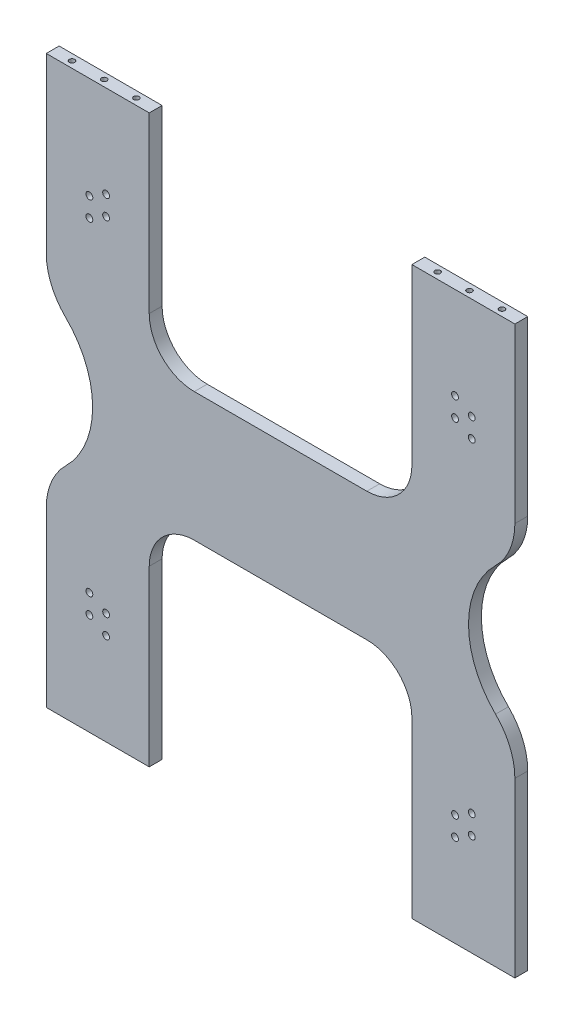
from build123d import *

# Parameters (mm, degrees)
SALIENTE_EXTRUIR1_DEPTH                              = 10
PERFORADOR_PARA_ROSCAR_PARA_MACHO_DE_2_COUNT         = 2
PERFORADOR_PARA_ROSCAR_PARA_MACHO_DE_2_PITCH         = 50
PERFORADOR_PARA_ROSCAR_PARA_MACHO_DE_3_COUNT         = 2
PERFORADOR_PARA_ROSCAR_PARA_MACHO_DE_3_PITCH         = 114.274917137
PERFORADOR_PARA_ROSCAR_PARA_MACHO_DE_4_COUNT         = 2
PERFORADOR_PARA_ROSCAR_PARA_MACHO_DE_4_PITCH         = 25
PERFORADOR_PARA_ROSCAR_PARA_MACHO_DE_5_A_COUNT       = 2
PERFORADOR_PARA_ROSCAR_PARA_MACHO_DE_5_A_PITCH       = 50
PERFORADOR_PARA_ROSCAR_PARA_MACHO_DE_6_COUNT         = 2
PERFORADOR_PARA_ROSCAR_PARA_MACHO_DE_6_PITCH         = 24.875395913
REFRENTADO_PARA_TORNILLO_TAP_N_CON_CABEZ_D           = 5.3
REFRENTADO_PARA_TORNILLO_TAP_N_CON_CABEZ_CSINK_D     = 11.2
REFRENTADO_PARA_TORNILLO_TAP_N_CON_CABEZ_CSINK_ANGLE = 90
SIMETR_A3_COPY_1_D                                   = 5.3
SIMETR_A3_COPY_1_CSINK_D                             = 11.2
SIMETR_A3_COPY_1_CSINK_ANGLE                         = 90


with BuildPart() as part:
    # Croquis1 → Saliente-Extruir1 (new body)
    with BuildSketch(Plane.XY):
        with BuildLine():
            Line((-67.025, 50), (67.025, 50))
            ThreePointArc((67.025, 50), (91.773737342, 60.251262658), (102.025, 85))
            Line((102.025, 85), (102.025, 220))
            Line((102.025, 220), (182.025, 220))
            Line((182.025, 220), (182.025, 85.714285714))
            ThreePointArc((182.025, 85.714285714), (178.120745631, 66.344664275), (167.017710611, 50))
            ThreePointArc((167.017710611, 50), (146.007505467, 0), (167.017710611, -50))
            ThreePointArc((167.017710611, -50), (178.120745631, -66.344664275), (182.025, -85.714285714))
            Line((182.025, -85.714285714), (182.025, -220))
            Line((182.025, -220), (102.025, -220))
            Line((102.025, -220), (102.025, -85))
            ThreePointArc((102.025, -85), (91.773737342, -60.251262658), (67.025, -50))
            Line((67.025, -50), (-67.025, -50))
            ThreePointArc((-67.025, -50), (-91.773737342, -60.251262658), (-102.025, -85))
            Line((-102.025, -85), (-102.025, -220))
            Line((-102.025, -220), (-182.025, -220))
            Line((-182.025, -220), (-182.025, -85.714285714))
            ThreePointArc((-182.025, -85.714285714), (-178.120745631, -66.344664275), (-167.017710611, -50))
            ThreePointArc((-167.017710611, -50), (-146.007505467, 0), (-167.017710611, 50))
            ThreePointArc((-167.017710611, 50), (-178.120745631, 66.344664275), (-182.025, 85.714285714))
            Line((-182.025, 85.714285714), (-182.025, 220))
            Line((-182.025, 220), (-102.025, 220))
            Line((-102.025, 220), (-102.025, 85))
            ThreePointArc((-102.025, 85), (-91.773737342, 60.251262658), (-67.025, 50))
        make_face()
    extrude(amount=SALIENTE_EXTRUIR1_DEPTH)

    # Croquis3 → Perforador para roscar para macho de ros (revolve, cut)
    with BuildSketch(Plane(origin=(-167.025, 220, 5), x_dir=(0, 0, 1), z_dir=(1, 0, 0))):
        Polygon((0, 0), (0, 76.2618073), (2.1, 75), (2.1, 0), align=None)
    perforador_para_roscar_para_macho_de_ros = revolve(axis=Axis((-167.025, 226.35, 5), (0, -1, 0)), mode=Mode.SUBTRACT)

    # Perforador para roscar para macho de 2: Perforador para roscar para macho de ros ×2
    with Locations(*[(i * PERFORADOR_PARA_ROSCAR_PARA_MACHO_DE_2_PITCH, 0, 0) for i in range(1, PERFORADOR_PARA_ROSCAR_PARA_MACHO_DE_2_COUNT)]):
        add(perforador_para_roscar_para_macho_de_ros, mode=Mode.SUBTRACT)

    # Perforador para roscar para macho de 3: Perforador para roscar para macho de ros ×2
    with Locations(*[Vector(-0.9105437359751597, 0, -0.4134127536450694) * (i * PERFORADOR_PARA_ROSCAR_PARA_MACHO_DE_3_PITCH) for i in range(1, PERFORADOR_PARA_ROSCAR_PARA_MACHO_DE_3_COUNT)]):
        add(perforador_para_roscar_para_macho_de_ros, mode=Mode.SUBTRACT)

    # Perforador para roscar para macho de 4: Perforador para roscar para macho de ros ×2
    with Locations(*[(i * PERFORADOR_PARA_ROSCAR_PARA_MACHO_DE_4_PITCH, 0, 0) for i in range(1, PERFORADOR_PARA_ROSCAR_PARA_MACHO_DE_4_COUNT)]):
        add(perforador_para_roscar_para_macho_de_ros, mode=Mode.SUBTRACT)

    # Croquis5 → Perforador para roscar para macho de 5 (revolve, cut)
    with BuildSketch(Plane(origin=(117.025, 220, 5), x_dir=(0, 0, 1), z_dir=(1, 0, 0))):
        Polygon((0, 0), (0, 76.2618073), (2.1, 75), (2.1, 0), align=None)
    perforador_para_roscar_para_macho_de_5 = revolve(axis=Axis((117.025, 226.35, 5), (0, -1, 0)), mode=Mode.SUBTRACT)

    # Perforador para roscar para macho de 5 a: Perforador para roscar para macho de 5 ×2
    with Locations(*[(i * PERFORADOR_PARA_ROSCAR_PARA_MACHO_DE_5_A_PITCH, 0, 0) for i in range(1, PERFORADOR_PARA_ROSCAR_PARA_MACHO_DE_5_A_COUNT)]):
        add(perforador_para_roscar_para_macho_de_5, mode=Mode.SUBTRACT)

    # Perforador para roscar para macho de 6: Perforador para roscar para macho de 5 ×2
    with Locations(*[Vector(0.9999846303252095, 0, 0.005544286550521713) * (i * PERFORADOR_PARA_ROSCAR_PARA_MACHO_DE_6_PITCH) for i in range(1, PERFORADOR_PARA_ROSCAR_PARA_MACHO_DE_6_COUNT)]):
        add(perforador_para_roscar_para_macho_de_5, mode=Mode.SUBTRACT)

    # Simetría1: Perforador para roscar para macho de ros, Perforador para roscar para macho de 5 across plane
    add(perforador_para_roscar_para_macho_de_ros.mirror(Plane.ZX), mode=Mode.SUBTRACT)
    add(perforador_para_roscar_para_macho_de_5.mirror(Plane.ZX), mode=Mode.SUBTRACT)

    # Simetría1 copy 1 sketch → Simetría1 copy 1 (revolve, cut)
    with BuildSketch(Plane(origin=(-117.025, -220, 5), x_dir=(0, 0, 1), z_dir=(1, 0, 0))):
        Polygon((0, 0), (0, -76.2618073), (2.1, -75), (2.1, 0), align=None)
    revolve(axis=Axis((-117.025, -226.35, 5), (0, -1, 0)), mode=Mode.SUBTRACT)

    # Simetría1 copy 2 sketch → Simetría1 copy 2 (revolve, cut)
    with BuildSketch(Plane(origin=(-271.077309978, -220, -42.242708166), x_dir=(0, 0, 1), z_dir=(1, 0, 0))):
        Polygon((0, 0), (0, -76.2618073), (2.1, -75), (2.1, 0), align=None)
    revolve(axis=Axis((-271.077309978, -226.35, -42.242708166), (0, -1, 0)), mode=Mode.SUBTRACT)

    # Simetría1 copy 3 sketch → Simetría1 copy 3 (revolve, cut)
    with BuildSketch(Plane(origin=(-142.025, -220, 5), x_dir=(0, 0, 1), z_dir=(1, 0, 0))):
        Polygon((0, 0), (0, -76.2618073), (2.1, -75), (2.1, 0), align=None)
    revolve(axis=Axis((-142.025, -226.35, 5), (0, -1, 0)), mode=Mode.SUBTRACT)

    # Simetría1 copy 4 sketch → Simetría1 copy 4 (revolve, cut)
    with BuildSketch(Plane(origin=(167.025, -220, 5), x_dir=(0, 0, 1), z_dir=(1, 0, 0))):
        Polygon((0, 0), (0, -76.2618073), (2.1, -75), (2.1, 0), align=None)
    revolve(axis=Axis((167.025, -226.35, 5), (0, -1, 0)), mode=Mode.SUBTRACT)

    # Simetría1 copy 5 sketch → Simetría1 copy 5 (revolve, cut)
    with BuildSketch(Plane(origin=(141.900013587, -220, 5.137916323), x_dir=(0, 0, 1), z_dir=(1, 0, 0))):
        Polygon((0, 0), (0, -76.2618073), (2.1, -75), (2.1, 0), align=None)
    revolve(axis=Axis((141.900013587, -226.35, 5.137916323), (0, -1, 0)), mode=Mode.SUBTRACT)

    # Refrentado para tornillo tapón con cabeza plana de clavija de M51 (through all)
    with Locations(Plane(origin=(148.520190528, -141, 0), x_dir=(-1, 0, 0), z_dir=(0, 0, -1))):
        with Locations((0, 0), (12.990381056, 7.5), (12.990381056, -7.5), (0, 15)):
            refrentado_para_tornillo_tap_n_con_cabez = CounterSinkHole(REFRENTADO_PARA_TORNILLO_TAP_N_CON_CABEZ_D / 2, REFRENTADO_PARA_TORNILLO_TAP_N_CON_CABEZ_CSINK_D / 2, counter_sink_angle=REFRENTADO_PARA_TORNILLO_TAP_N_CON_CABEZ_CSINK_ANGLE)

    # Simetría2: Refrentado para tornillo tapón con cabeza plana de clavija de M51 across plane
    add(refrentado_para_tornillo_tap_n_con_cabez.mirror(Plane.ZX), mode=Mode.SUBTRACT)

    # Simetría3: Refrentado para tornillo tapón con cabeza plana de clavija de M51 across plane
    add(refrentado_para_tornillo_tap_n_con_cabez.mirror(Plane(origin=(0, 0, 0), x_dir=(0, 0, 1), z_dir=(1, 0, 0))), mode=Mode.SUBTRACT)

    # Simetría3 copy 1 (through all)
    with Locations(Plane(origin=(-148.520190528, 141, 0), x_dir=(1, 0, 0), z_dir=(0, 0, -1))):
        with Locations((0, 0), (12.990381056, 7.5), (12.990381056, -7.5), (0, 15)):
            CounterSinkHole(SIMETR_A3_COPY_1_D / 2, SIMETR_A3_COPY_1_CSINK_D / 2, counter_sink_angle=SIMETR_A3_COPY_1_CSINK_ANGLE)


solid = part.part
